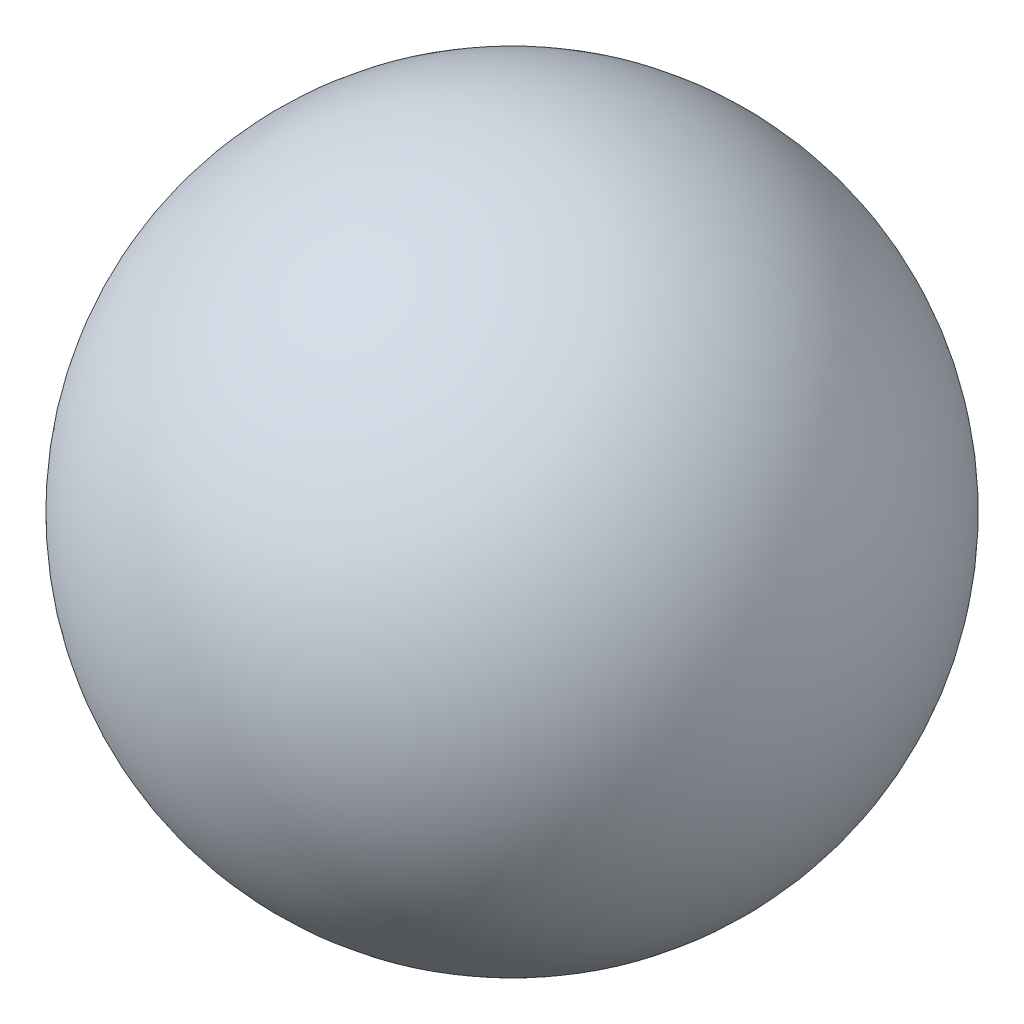
from build123d import *


with BuildPart() as part:
    # Esquisse1 → Révolution1 (revolve)
    with BuildSketch(Plane.XY):
        with BuildLine():
            Line((0, 8), (0, -8))
            ThreePointArc((0, -8), (8, 0), (0, 8))
        make_face()
    revolve(axis=Axis((0, 8, 0), (0, -1, 0)))


solid = part.part
